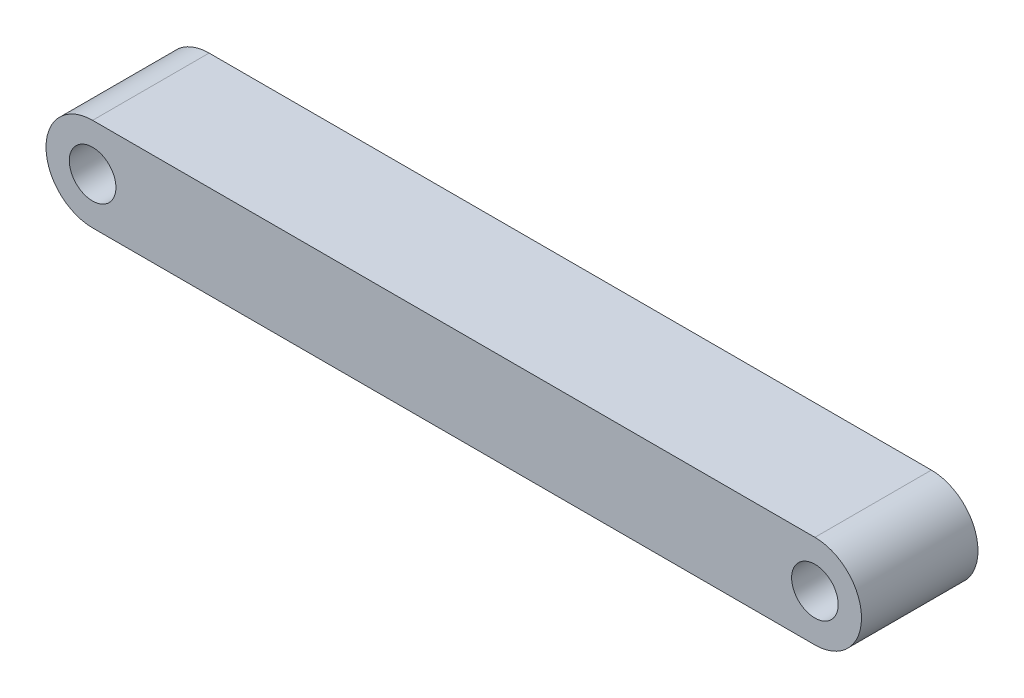
from build123d import *

# Parameters (mm, degrees)
CROQUIS1_R              = 2
SALIENTE_EXTRUIR1_DEPTH = 10


with BuildPart() as part:
    # Croquis1 → Saliente-Extruir1 (new body)
    with BuildSketch(Plane.XY):
        with BuildLine():
            Line((0, 4), (62, 4))
            ThreePointArc((62, 4), (66, 0), (62, -4))
            Line((62, -4), (0, -4))
            ThreePointArc((0, -4), (-4, 0), (0, 4))
        make_face()
        Circle(CROQUIS1_R, mode=Mode.SUBTRACT)
        with Locations((62, 0)):
            Circle(CROQUIS1_R, mode=Mode.SUBTRACT)
    extrude(amount=SALIENTE_EXTRUIR1_DEPTH)


solid = part.part
